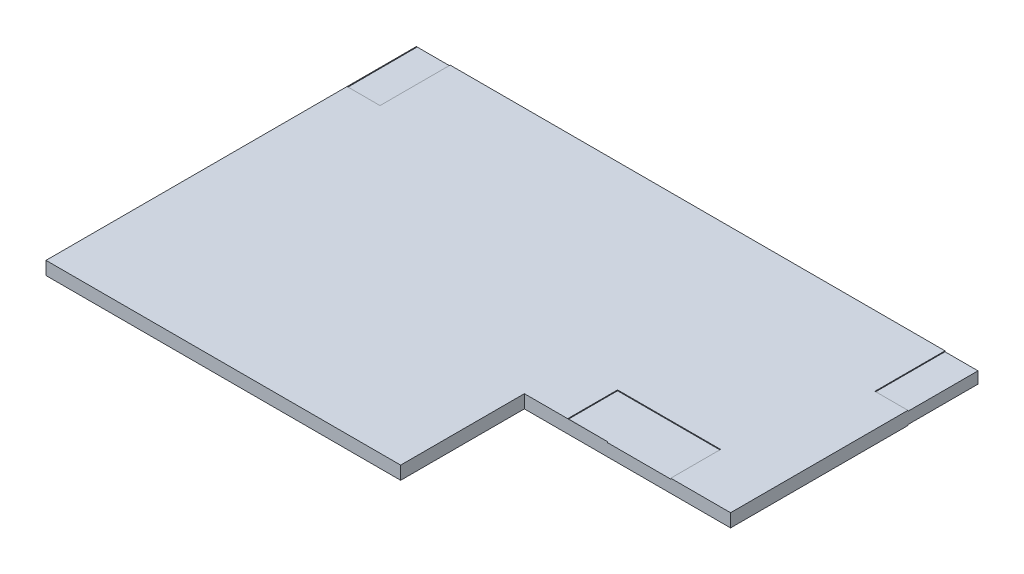
from build123d import *

# Parameters (mm, degrees)
ESQUISSE1_W             = 68
ESQUISSE1_H             = 1.6
EXTRUSION1_DEPTH        = 45
ESQUISSE2_W             = 25
ESQUISSE2_H             = 34
ENL_V_MAT_EXTRU_1_DEPTH = 2
ESQUISSE4_W             = 4.000005344
ESQUISSE4_H             = 8.5
ENL_V_MAT_EXTRU_2_DEPTH = 0.1
ESQUISSE5_W             = 4.000005344
ESQUISSE5_H             = 8.5
ENL_V_MAT_EXTRU_3_DEPTH = 0.1


with BuildPart() as part:
    # Esquisse1 → Extrusion1 (new body)
    with BuildSketch(Plane.XY):
        with Locations((57.011095297, 71.602293989)):
            Rectangle(ESQUISSE1_W, ESQUISSE1_H)
    extrude(amount=EXTRUSION1_DEPTH)

    # Esquisse2 → Enlèv. mat.-Extru.1 (cut)
    with BuildSketch(Plane(origin=(0, 72.402293989, 0), x_dir=(-1, 0, 0), z_dir=(0, 1, 0))):
        with Locations((-78.511095297, 47)):
            Rectangle(ESQUISSE2_W, ESQUISSE2_H)
    extrude(amount=-ENL_V_MAT_EXTRU_1_DEPTH, mode=Mode.SUBTRACT)

    # Esquisse4 → Enlèv. mat.-Extru.2 (cut)
    with BuildSketch(Plane(origin=(0, 72.402293989, 0), x_dir=(-1, 0, 0), z_dir=(0, 1, 0))):
        with Locations((-89.011092625, 4.25)):
            Rectangle(ESQUISSE4_W, ESQUISSE4_H)
        Polygon((-27.011089953, 8.5), (-27.011089953, 0), (-23.011095297, 0), (-23.029811449, 8.5), align=None)
        Polygon((-83.761089902, 23.952607164), (-71.261089902, 23.952607164), (-71.261089902, 29.947835896), (-83.761089902, 30.082433695), align=None)
    extrude(amount=-ENL_V_MAT_EXTRU_2_DEPTH, mode=Mode.SUBTRACT)

    # Esquisse5 → Enlèv. mat.-Extru.3 (cut)
    with BuildSketch(Plane.XZ.offset(-70.802293989)):
        Polygon((23.029811449, 8.5), (23.011095297, 0), (27.011089953, 0), (27.011089953, 8.5), align=None)
        with Locations((89.011092625, 4.25)):
            Rectangle(ESQUISSE5_W, ESQUISSE5_H)
    extrude(amount=-ENL_V_MAT_EXTRU_3_DEPTH, mode=Mode.SUBTRACT)


solid = part.part
